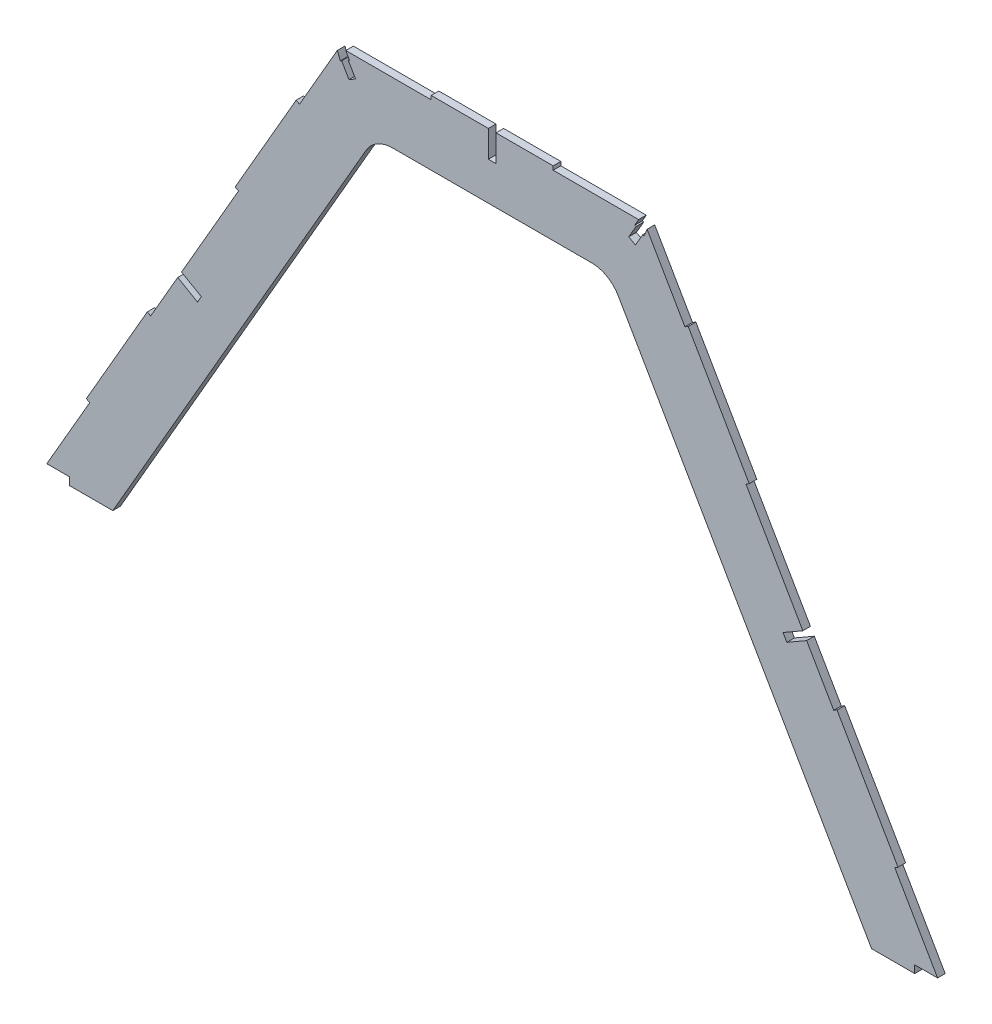
from build123d import *

# Parameters (mm, degrees)
BOSS_EXTRUDE1_DEPTH = 3.175
FILLET1_R           = 12.7
SKETCH3_W           = 50.8
SKETCH3_H           = 1.5875
BOSS_EXTRUDE2_DEPTH = 3.175
CUT_EXTRUDE1_DEPTH  = 305.700701144
CUT_EXTRUDE2_DEPTH  = 305.700701144
CUT_EXTRUDE3_REACH  = 306.045
SKETCH6_W           = 3.175
SKETCH6_H           = 11.1125
CUT_EXTRUDE5_START  = -3.175
CUT_EXTRUDE5_DEPTH  = 3.175
SKETCH8_W           = 471.002245988
SKETCH8_H           = 22.673608405
CUT_EXTRUDE6_DEPTH  = 305.045309672


with BuildPart() as part:
    # Sketch1 → Boss-Extrude1 (new body)
    with BuildSketch(Plane.XY):
        Polygon((-196.85, 0), (-63.5, 230.968975189), (63.5, 230.968975189), (196.85, 0), (167.520606325, 0), (48.835303163, 205.568975189), (-48.835303163, 205.568975189), (-167.520606325, 0), align=None)
    extrude(amount=BOSS_EXTRUDE1_DEPTH)

    # Fillet1
    fillet1_edges = [part.edges().sort_by_distance(p)[0] for p in [
        (167.520606325, 0, 1.5875),
        (48.835303163, 205.568975189, 1.5875),
        (-48.835303163, 205.568975189, 1.5875),
        (-167.520606325, 0, 1.5875),
    ]]
    fillet(fillet1_edges, radius=FILLET1_R)

    # Sketch3 → Boss-Extrude2 (add)
    with BuildSketch(Plane(origin=(0, 0, 0), x_dir=(-1, 0, 0), z_dir=(0, 0, -1))):
        Polygon((81.638815329, 202.726625451), (80.264, 201.932875451), (105.664, 157.938784939), (107.038815329, 158.732534939), align=None)
        Polygon((143.614815329, 95.381044601), (142.24, 94.587294601), (167.64, 50.593204089), (169.014815329, 51.386954089), align=None)
        with Locations((0, 231.762725189)):
            Rectangle(SKETCH3_W, SKETCH3_H)
    boss_extrude2 = extrude(amount=-BOSS_EXTRUDE2_DEPTH)

    # Sketch5 → Cut-Extrude1 (cut, through all)
    with BuildSketch(Plane(origin=(0, 0, 0), x_dir=(-1, 0, 0), z_dir=(0, 0, -1))):
        Polygon((-175.966912895, 19.672783942), (-185.491912895, 19.672783942), (-187.325, 16.497783942), (-186.309, 16.497783942), (-175.966912895, 16.497783942), align=None)
        Polygon((-186.309, 16.497783942), (-187.325, 16.497783942), (-196.85, 0), (-195.834, 0), align=None)
        Polygon((-121.132358029, 112.096802923), (-129.38125, 116.859302923), (-130.96875, 114.109672266), (-122.719858029, 109.347172266), align=None)
    cut_extrude1 = extrude(amount=-CUT_EXTRUDE1_DEPTH, mode=Mode.SUBTRACT)

    # Sketch4 → Cut-Extrude2 (cut, through all)
    with BuildSketch(Plane(origin=(0, 0, 0), x_dir=(-1, 0, 0), z_dir=(0, 0, -1))):
        Polygon((-61.666912895, 230.968975189), (-56.904412895, 222.720083218), (-59.654043552, 221.132583218), (-64.416543552, 229.381475189), (-63.5, 230.968975189), align=None)
    cut_extrude2 = extrude(amount=-CUT_EXTRUDE2_DEPTH, mode=Mode.SUBTRACT)

    # Mirror1: Boss-Extrude2, Cut-Extrude1, Cut-Extrude2 across plane
    add(boss_extrude2.mirror(Plane(origin=(0, 0, 0), x_dir=(0, 0, 1), z_dir=(1, 0, 0))))
    add(cut_extrude1.mirror(Plane(origin=(0, 0, 0), x_dir=(0, 0, 1), z_dir=(1, 0, 0))), mode=Mode.SUBTRACT)
    add(cut_extrude2.mirror(Plane(origin=(0, 0, 0), x_dir=(0, 0, 1), z_dir=(1, 0, 0))), mode=Mode.SUBTRACT)

    # Sketch6 → Cut-Extrude3 (cut, up to next)
    with BuildSketch(Plane(origin=(0, 0, 0), x_dir=(-1, 0, 0), z_dir=(0, 0, -1)), mode=Mode.PRIVATE) as cut_extrude3_sk1:
        with Locations((0, 227.000225189)):
            Rectangle(SKETCH6_W, SKETCH6_H)
    cut_extrude3_tool1 = extrude(cut_extrude3_sk1.sketch, amount=-CUT_EXTRUDE3_REACH, mode=Mode.PRIVATE) & part.part
    add(cut_extrude3_tool1.solids().sort_by_distance((0, 227.000225, 0))[0], mode=Mode.SUBTRACT)

    # Sketch7 → Cut-Extrude5 (cut)
    with BuildSketch(Plane(origin=(0, 0, 0), x_dir=(-1, 0, 0), z_dir=(0, 0, -1)).offset(CUT_EXTRUDE5_START)):
        Polygon((-61.666912895, 230.968975189), (-64.416543552, 229.381475189), (-62.698387042, 226.405540819), (-59.400779492, 228.178478093), (-60.980004947, 230.968975189), align=None)
        Polygon((-64.416543552, 229.381475189), (-64.498587563, 229.239370794), (-63.247784195, 226.110161009), (-62.698387042, 226.405540819), align=None)
        Polygon((64.498587563, 229.239370794), (63.247784195, 226.110161009), (59.400779492, 228.178478093), (60.980004947, 230.968975189), (61.666912895, 230.968975189), (64.416543552, 229.381475189), align=None)
    extrude(amount=CUT_EXTRUDE5_DEPTH, mode=Mode.SUBTRACT)

    # Sketch8 → Cut-Extrude6 (cut, through all)
    with BuildSketch(Plane(origin=(0, 0, 0), x_dir=(-1, 0, 0), z_dir=(0, 0, -1))):
        with Locations((-11.378610212, 5.16097974)):
            Rectangle(SKETCH8_W, SKETCH8_H)
    extrude(amount=-CUT_EXTRUDE6_DEPTH, mode=Mode.SUBTRACT)


solid = part.part
